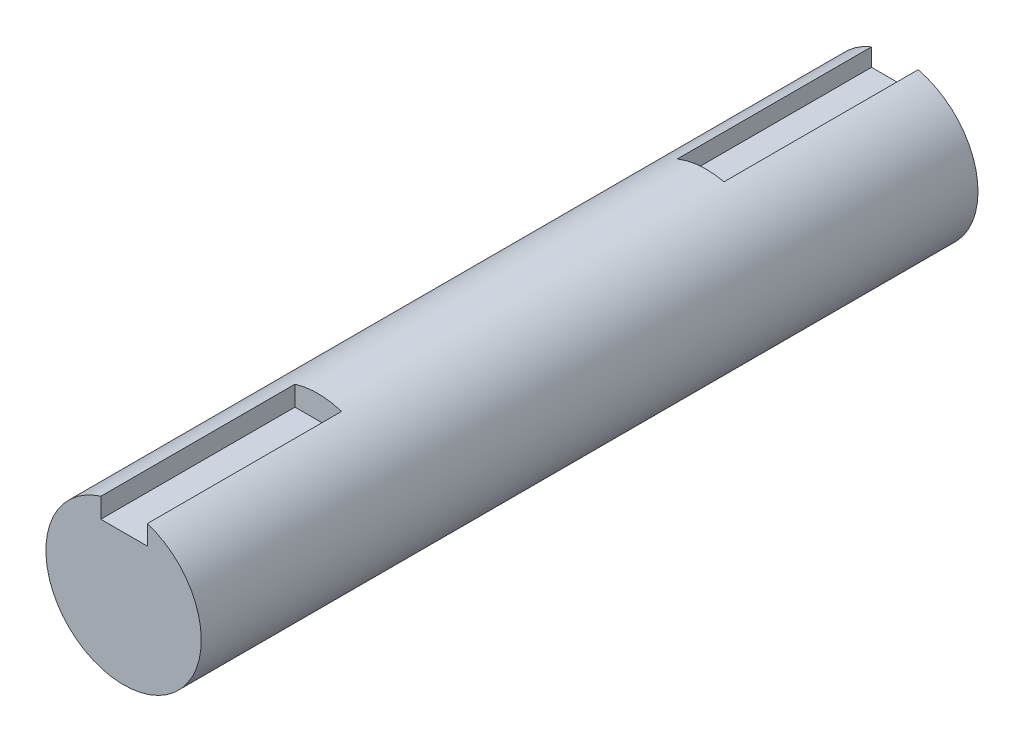
from build123d import *

# Parameters (mm, degrees)
SKETCH1_R           = 10
SHAFT_D20X100_DEPTH = 100
SKETCH3_W           = 6
SKETCH3_H           = 3
KEYWAY_6X25_DEPTH   = 25
SKETCH4_W           = 6
SKETCH4_H           = 3
KEYWAT2_6X25_DEPTH  = 25


with BuildPart() as part:
    # Sketch1 → Shaft_D20x100 (new body)
    with BuildSketch(Plane.XY):
        with Locations(Location((0, 0, 0), (0, 0, 180))):
            Circle(SKETCH1_R)
    extrude(amount=SHAFT_D20X100_DEPTH)

    # Sketch3 → Keyway_6x25 (cut)
    with BuildSketch(Plane(origin=(0, 0, 0), x_dir=(-1, 0, 0), z_dir=(0, 0, -1))):
        with Locations((0.706795811, 8.5)):
            Rectangle(SKETCH3_W, SKETCH3_H)
    extrude(amount=-KEYWAY_6X25_DEPTH, mode=Mode.SUBTRACT)

    # Sketch4 → keywat2_6x25 (cut)
    with BuildSketch(Plane.XY.offset(100)):
        with Locations((0.063890127, 8.5)):
            Rectangle(SKETCH4_W, SKETCH4_H)
    extrude(amount=-KEYWAT2_6X25_DEPTH, mode=Mode.SUBTRACT)


solid = part.part
